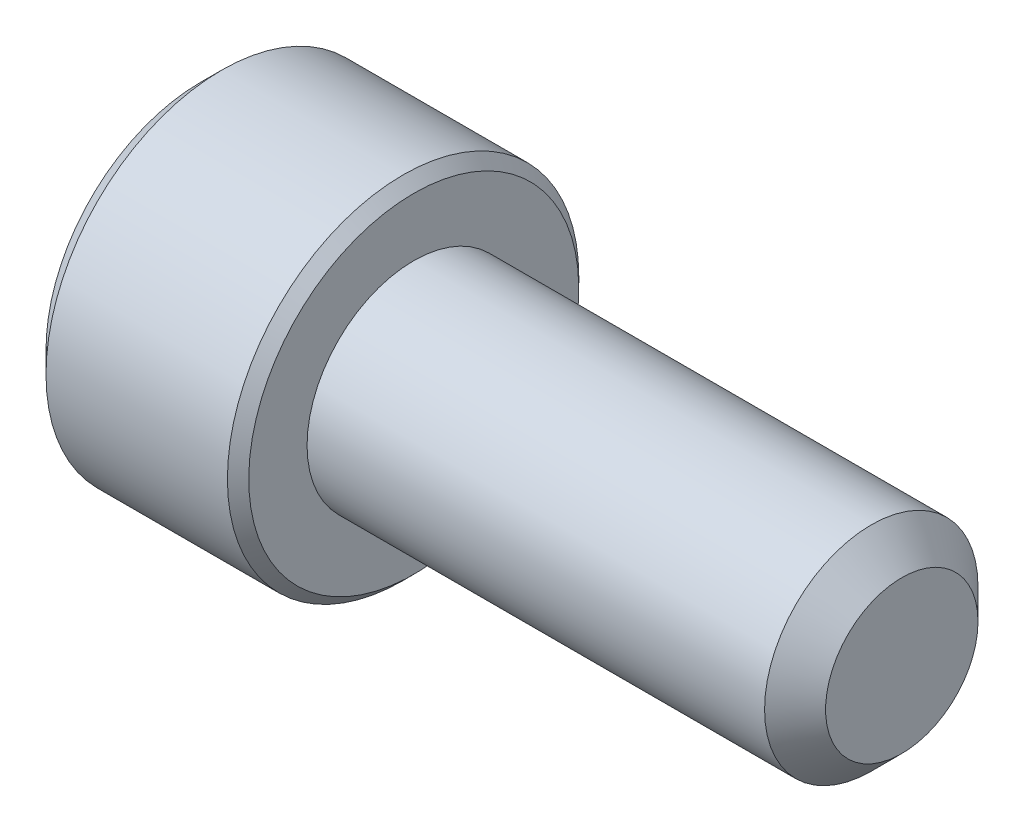
from build123d import *

# Parameters (mm, degrees)
SKETCH2_R           = 2.0828
BOSS_EXTRUDE1_DEPTH = 9.525
CHAMFER1_SIZE       = 0.5953125
CUT_EXTRUDE1_DEPTH  = 2.678906
SKETCH8_R           = 2.062222993
CUT_EXTRUDE2_DEPTH  = 0.83312
CUT_EXTRUDE2_DRAFT  = -45


with BuildPart() as part:
    # Sketch2 → Boss-Extrude1 (new body)
    with BuildSketch(Plane(origin=(4.7625, 0, 0), x_dir=(0, 0, -1), z_dir=(1, 0, 0))):
        Circle(SKETCH2_R)
    extrude(amount=-BOSS_EXTRUDE1_DEPTH)

    # Chamfer1
    chamfer1_edges = [part.edges().sort_by_distance(p)[0] for p in [
        (4.7625, 0, 2.0828),
    ]]
    chamfer(chamfer1_edges, length=CHAMFER1_SIZE)

    # Sketch6 → Revolve1 (revolve)
    with BuildSketch(Plane.XY):
        Polygon((-8.51154, 3.429), (-8.9281, 3.01244), (-8.9281, 0), (-4.7625, 0), (-4.7625, 3.22072), (-4.97078, 3.429), align=None)
    revolve(axis=Axis((-4.7625, 0, 0), (-1, 0, 0)))

    # Sketch4 → Cut-Extrude1 (cut)
    with BuildSketch(Plane(origin=(-8.9281, 0, 0), x_dir=(0, 0, -1), z_dir=(1, 0, 0))):
        Polygon((0, 2.062222993), (-1.7859375, 1.031111496), (-1.7859375, -1.031111496), (0, -2.062222993), (1.7859375, -1.031111496), (1.7859375, 1.031111496), align=None)
    extrude(amount=CUT_EXTRUDE1_DEPTH, mode=Mode.SUBTRACT)


with BuildPart() as cut_extrude2_tool:
    # Sketch8 → Cut-Extrude2 (with draft: the straight prism first)
    with BuildSketch(Plane.ZY.offset(8.9281)):
        Circle(SKETCH8_R)
    extrude(amount=-CUT_EXTRUDE2_DEPTH)
    # Cut-Extrude2: the draft: its side faces are tilted about the plane it starts from
    cut_extrude2_sides = [cut_extrude2_tool.faces().sort_by_distance(p)[0] for p in [
        (-8.51154, 0, -2.062222993),
    ]]
    draft(cut_extrude2_sides, Plane.ZY.offset(8.9281), CUT_EXTRUDE2_DRAFT)


with BuildPart() as part_1:
    add(part.part)

    # Cut-Extrude2: cut by cut_extrude2_tool
    add(cut_extrude2_tool.part, mode=Mode.SUBTRACT)


solid = part_1.part
